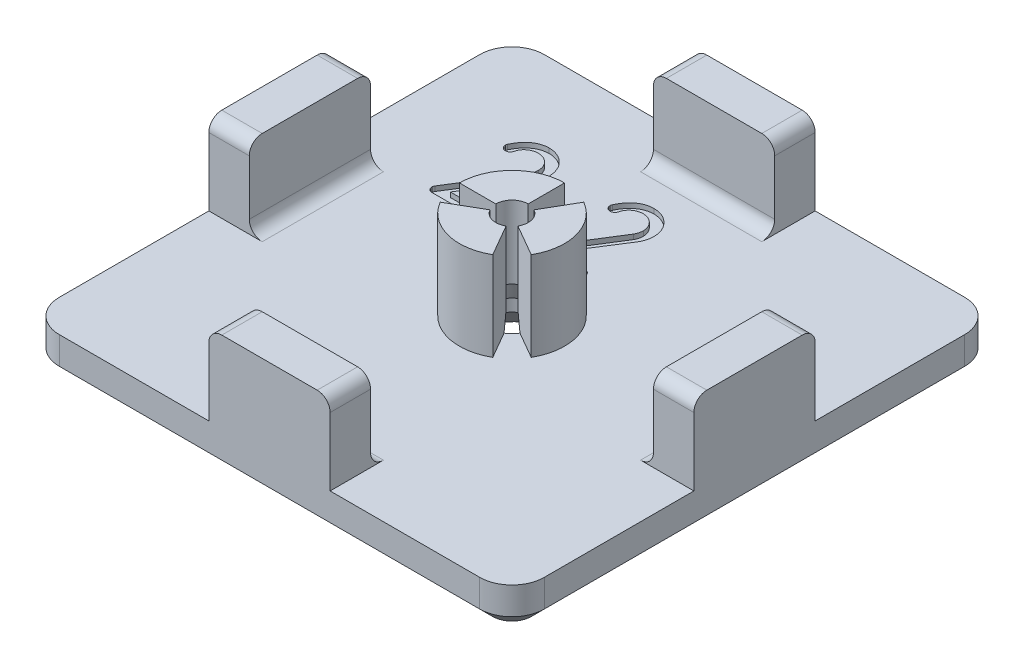
from build123d import *

# Parameters (mm, degrees)
SKETCH2_W                = 30
SKETCH2_H                = 30
EXTRUDE_MAIN_FACE_DEPTH  = 2.5
FILLET1_R                = 2
CHAMFER_BOTTOM_SIZE      = 0.8
SKETCH3_R                = 3.25
CENTER_PEG_DEPTH         = 5.5
SKETCH7_W                = 2.5
SKETCH7_H                = 7.5
BOSS_EXTRUDE1_DEPTH      = 5
FILLET7_R                = 0.8
CIRPATTERN6_COUNT        = 4
FILLET7_OF_CIRPATTERN6_R = 0.8
CUT_CYLINDER_NOTCH_REACH = 24.672
CIRPATTERN7_COUNT        = 3
CHAMF_SCREWHOLE_SIZE     = 1.75
CUT_VERSION_NUMBER_DEPTH = 0.3


with BuildPart() as part:
    # Sketch2 → extrude main face (new body)
    with BuildSketch(Plane(origin=(0, 0, 0), x_dir=(1, 0, 0), z_dir=(0, 1, 0))):
        Rectangle(SKETCH2_W, SKETCH2_H)
    extrude(amount=EXTRUDE_MAIN_FACE_DEPTH)

    # Fillet1
    fillet1_edges = [part.edges().sort_by_distance(p)[0] for p in [
        (15, 1.25, 15),
        (-15, 1.25, 15),
        (-15, 1.25, -15),
        (15, 1.25, -15),
    ]]
    fillet(fillet1_edges, radius=FILLET1_R)

    # chamfer bottom
    chamfer_bottom_edges = [part.edges().sort_by_distance(p)[0] for p in [
        (0, 0, -15),
        (15, 0, 0),
        (0, 0, 15),
        (-15, 0, 0),
        (14.414213562, 0, 14.414213562),
        (-14.414213562, 0, 14.414213562),
        (-14.414213562, 0, -14.414213562),
        (14.414213562, 0, -14.414213562),
    ]]
    chamfer(chamfer_bottom_edges, length=CHAMFER_BOTTOM_SIZE)

    # Sketch3 → center peg (add)
    with BuildSketch(Plane(origin=(0, 2.5, 0), x_dir=(1, 0, 0), z_dir=(0, 1, 0))):
        with Locations(Location((0, 0, 0), (0, 0, 270))):
            Circle(SKETCH3_R)
    extrude(amount=CENTER_PEG_DEPTH)

    # Sketch7 → Boss-Extrude1 (add)
    with BuildSketch(Plane(origin=(0, 2.5, 0), x_dir=(1, 0, 0), z_dir=(0, 1, 0))):
        with Locations((-13.75, 0)):
            Rectangle(SKETCH7_W, SKETCH7_H)
    boss_extrude1 = extrude(amount=BOSS_EXTRUDE1_DEPTH)

    # Fillet7
    fillet7_edges = [part.edges().sort_by_distance(p)[0] for p in [
        (-12.5, 2.5, 0),
        (-13.75, 7.5, 3.75),
        (-13.75, 7.5, -3.75),
    ]]
    fillet(fillet7_edges, radius=FILLET7_R)

    # CirPattern6: Boss-Extrude1 ×4 about axis
    cirpattern6_axis = Axis((0, 0, 0), (0, 1, 0))
    for i in range(1, CIRPATTERN6_COUNT):
        add(boss_extrude1.rotate(cirpattern6_axis, i * 360 / CIRPATTERN6_COUNT))

    # Fillet7 of CirPattern6
    fillet7_of_cirpattern6_edges = [part.edges().sort_by_distance(p)[0] for p in [
        (0, 2.5, 12.5),
        (3.75, 7.5, 13.75),
        (-3.75, 7.5, 13.75),
        (12.5, 2.5, 0),
        (13.75, 7.5, -3.75),
        (13.75, 7.5, 3.75),
        (0, 2.5, -12.5),
        (-3.75, 7.5, -13.75),
        (3.75, 7.5, -13.75),
    ]]
    fillet(fillet7_of_cirpattern6_edges, radius=FILLET7_OF_CIRPATTERN6_R)

    # Sketch8 → Cut-Revolve1 (revolve, cut)
    with BuildSketch(Plane.XY, mode=Mode.PRIVATE) as cut_revolve1_sk:
        Polygon((0, 0), (0, 8), (1, 8), (1, 3.5), (1.35, 2.5), (1.35, 0), align=None)
    revolve(cut_revolve1_sk.sketch.rotate(Axis((0, 0, 0), (0, 1, 0)), 90), axis=Axis((0, 0, 0), (0, 1, 0)), mode=Mode.SUBTRACT)

    # cut cylinder notch: up to this face of the body (flat: up to its plane)
    cut_cylinder_notch_end = Plane(part.part.faces().sort_by_distance((-4.174264069, 2.5, 13.35))[0])
    # Sketch9 → cut cylinder notch (cut, up to the picked face)
    with BuildSketch(Plane(origin=(0, 8, 0), x_dir=(1, 0, 0), z_dir=(0, 1, 0)), mode=Mode.PRIVATE) as cut_cylinder_notch_sk1:
        with BuildLine():
            Line((0, 0), (0, 3.25))
            ThreePointArc((0, 3.25), (0.841161897, 3.139258935), (1.625, 2.814582562))
            Line((1.625, 2.814582562), (0, 0))
        make_face()
    cut_cylinder_notch_tool1 = split(extrude(cut_cylinder_notch_sk1.sketch, amount=-CUT_CYLINDER_NOTCH_REACH, mode=Mode.PRIVATE), bisect_by=cut_cylinder_notch_end, keep=Keep.BOTH, mode=Mode.PRIVATE)
    cut_cylinder_notch = cut_cylinder_notch_tool1.solids().sort_by(Axis((0.554391, 8, -2.069014), (0, -1, 0)))[0]
    add(cut_cylinder_notch, mode=Mode.SUBTRACT)

    # CirPattern7: cut cylinder notch ×3 about axis
    cirpattern7_axis = Axis((0, 0, 0), (0, 1, 0))
    for i in range(1, CIRPATTERN7_COUNT):
        add(cut_cylinder_notch.rotate(cirpattern7_axis, i * 360 / CIRPATTERN7_COUNT), mode=Mode.SUBTRACT)

    # chamf screwHole
    chamf_screwhole_edges = [part.edges().sort_by_distance(p)[0] for p in [
        (0, 0, 1.35),
    ]]
    chamfer(chamf_screwhole_edges, length=CHAMF_SCREWHOLE_SIZE)

    # Sketch10 → cut version Number (cut)
    with BuildSketch(Plane(origin=(0, 2.5, 0), x_dir=(1, 0, 0), z_dir=(0, 1, 0))):
        with BuildLine():
            add(Edge.make_bspline(
                [(-6.564995585, 7.849162088), (-6.529853577, 7.910325815), (-6.459404249, 8.032940988), (-6.391603871, 8.233645799), (-6.346963765, 8.436853093), (-6.340784919, 8.573549532), (-6.337761401, 8.640439718)],
                knots=[0, 0, 0, 0, 1.013787966, 2.032344872, 3.037159877, 4, 4, 4, 4], degree=3))
            add(Edge.make_bspline(
                [(-6.337761401, 8.640439718), (-6.340521005, 8.69255195), (-6.345936009, 8.794808594), (-6.369313518, 8.94475644), (-6.406217036, 9.087902709), (-6.454906292, 9.225372551), (-6.517112927, 9.356361865), (-6.593675563, 9.479939943), (-6.681464601, 9.597412475), (-6.781310132, 9.706648801), (-6.89054966, 9.806480875), (-7.007996372, 9.894325933), (-7.13136068, 9.970487978), (-7.261622581, 10.033359658), (-7.398859249, 10.081689256), (-7.541974601, 10.118657688), (-7.691930868, 10.142017516), (-7.794186347, 10.147434964), (-7.846297986, 10.150195815)],
                knots=[0, 0, 0, 0, 1.058443009, 2.076917897, 3.073239101, 4.054247521, 5.031990651, 6.00955979, 6.999406302, 8.003719833, 9.008033365, 9.997879877, 10.975449016, 11.945752479, 12.926760899, 13.923082103, 14.941556991, 16, 16, 16, 16], degree=3))
            add(Edge.make_bspline(
                [(-7.846297986, 10.150195815), (-7.888216266, 10.14838627), (-7.970702041, 10.144825492), (-8.092674029, 10.128637178), (-8.210677712, 10.103402732), (-8.3243811, 10.067792617), (-8.433779889, 10.023147183), (-8.540109949, 9.971443336), (-8.641451616, 9.908332231), (-8.77148994, 9.81431157), (-8.92048571, 9.677685322), (-9.079987849, 9.493558871), (-9.220058481, 9.288578086), (-9.293245286, 9.138613981), (-9.330444328, 9.062390937)],
                knots=[0, 0, 0, 0, 0.775863489, 1.526725378, 2.27305486, 3.005618887, 3.727569145, 4.457348924, 5.189912951, 5.932977202, 7.423702791, 8.916361755, 10.432662988, 12, 12, 12, 12], degree=3))
            add(Edge.make_bspline(
                [(-9.330444328, 9.062390937), (-9.338062413, 9.043936463), (-9.353696096, 9.006064561), (-9.355254876, 8.965100879), (-9.356054084, 8.944098254)],
                knots=[0, 0, 0, 0, 0.974573408, 2, 2, 2, 2], degree=3))
            add(Edge.make_bspline(
                [(-9.356054084, 8.944098254), (-9.354414474, 8.923226517), (-9.351239612, 8.8828115), (-9.333271132, 8.825451755), (-9.30662223, 8.772951254), (-9.268012067, 8.728481735), (-9.223542548, 8.689871572), (-9.171042046, 8.663222669), (-9.113682301, 8.64525419), (-9.073267284, 8.642079328), (-9.052395547, 8.640439718)],
                knots=[0, 0, 0, 0, 1.052730986, 2.038457085, 3.010444171, 4, 4.989555829, 5.961542915, 6.947269014, 8, 8, 8, 8], degree=3))
            add(Edge.make_bspline(
                [(-9.052395547, 8.640439718), (-9.017691189, 8.644870073), (-8.951947902, 8.653262856), (-8.864045842, 8.698465552), (-8.795761969, 8.768697927), (-8.77044011, 8.828734774), (-8.757273596, 8.859951913)],
                knots=[0, 0, 0, 0, 1.065202536, 2.017899786, 2.969374635, 4, 4, 4, 4], degree=3))
            add(Edge.make_bspline(
                [(-8.757273596, 8.859951913), (-8.744010433, 8.909770858), (-8.718043062, 9.007309205), (-8.649339519, 9.140949453), (-8.559061771, 9.257475378), (-8.448131489, 9.354844956), (-8.322739534, 9.43429714), (-8.184741725, 9.492209079), (-8.036170871, 9.526853173), (-7.933877202, 9.532618762), (-7.88166384, 9.535561669)],
                knots=[0, 0, 0, 0, 1.030680226, 2.017923977, 2.987398872, 3.96827074, 4.96037523, 5.949767355, 6.953507688, 8, 8, 8, 8], degree=3))
            add(Edge.make_bspline(
                [(-7.88166384, 9.535561669), (-7.820272741, 9.52926254), (-7.700048614, 9.516926758), (-7.529374679, 9.460631454), (-7.375019137, 9.37494176), (-7.240445781, 9.261282689), (-7.127579157, 9.126543098), (-7.0441493, 8.972492337), (-6.993117668, 8.802052308), (-6.983928567, 8.68305819), (-6.979224816, 8.622147035)],
                knots=[0, 0, 0, 0, 1.043300576, 2.043128441, 3.020592189, 4.018068269, 5.011134672, 5.981974443, 6.967005516, 8, 8, 8, 8], degree=3))
            add(Edge.make_bspline(
                [(-6.979224816, 8.622147035), (-6.980382537, 8.580136756), (-6.982684581, 8.496602456), (-7.008735917, 8.374729262), (-7.046910578, 8.256241418), (-7.086171123, 8.183417796), (-7.106054084, 8.146537278)],
                knots=[0, 0, 0, 0, 1.010874498, 2.01004839, 2.992216505, 4, 4, 4, 4], degree=3))
            Line((-7.106054084, 8.146537278), (-9.3392584, 4.591906943))
            add(Edge.make_bspline(
                [(-9.3392584, 4.591906943), (-9.352590227, 4.569209283), (-9.380336525, 4.521970743), (-9.386828027, 4.467512033), (-9.390200425, 4.439220205)],
                knots=[0, 0, 0, 0, 0.960980606, 2, 2, 2, 2], degree=3))
            add(Edge.make_bspline(
                [(-9.390200425, 4.439220205), (-9.389025141, 4.418351244), (-9.386725114, 4.377510767), (-9.368831932, 4.319684204), (-9.341983034, 4.266859298), (-9.303380608, 4.222381486), (-9.258902796, 4.18377906), (-9.20607789, 4.156930162), (-9.148251327, 4.13903698), (-9.10741085, 4.136736953), (-9.086541889, 4.135561669)],
                knots=[0, 0, 0, 0, 1.045974665, 2.046968367, 3.014737927, 4, 4.985262073, 5.953031633, 6.954025335, 8, 8, 8, 8], degree=3))
            Line((-9.086541889, 4.135561669), (-6.67556747, 4.135561669))
            add(Edge.make_bspline(
                [(-6.67556747, 4.135561669), (-6.655109532, 4.136771741), (-6.614686088, 4.139162757), (-6.557250053, 4.1569288), (-6.504424812, 4.183779427), (-6.459947091, 4.222381387), (-6.42134464, 4.266859324), (-6.39449575, 4.319684197), (-6.376602565, 4.377510769), (-6.374302539, 4.418351244), (-6.373127255, 4.439220205)],
                knots=[0, 0, 0, 0, 1.028290674, 2.031829889, 3.002060474, 3.989828055, 4.977595636, 5.947826221, 6.951365436, 8, 8, 8, 8], degree=3))
            add(Edge.make_bspline(
                [(-6.373127255, 4.439220205), (-6.374213483, 4.460112437), (-6.376298672, 4.500218402), (-6.394779913, 4.556680288), (-6.421367337, 4.607996068), (-6.460013759, 4.651206838), (-6.504484121, 4.688722442), (-6.557567002, 4.71394922), (-6.615039168, 4.732166492), (-6.655904254, 4.734413484), (-6.676785791, 4.735561669)],
                knots=[0, 0, 0, 0, 1.058535215, 2.032026861, 2.993167411, 3.974516965, 4.958471876, 5.928450685, 6.941464785, 8, 8, 8, 8], degree=3))
            Line((-6.676785791, 4.735561669), (-8.546894642, 4.735561669))
            Line((-8.546894642, 4.735561669), (-6.564995585, 7.849162088))
        make_face()
        with BuildLine():
            add(Edge.make_bspline(
                [(-4.871707666, 4.442450007), (-4.870633506, 4.421317953), (-4.868543861, 4.380208146), (-4.85059255, 4.322065779), (-4.823306309, 4.269231318), (-4.785584494, 4.223539085), (-4.74021535, 4.185278213), (-4.688169899, 4.156630717), (-4.629905544, 4.139131758), (-4.58910021, 4.136769005), (-4.568249206, 4.135561669)],
                knots=[0, 0, 0, 0, 1.053795159, 2.050028647, 3.013195991, 4.009429478, 4.990006149, 5.962765968, 6.958999455, 8, 8, 8, 8], degree=3))
            add(Edge.make_bspline(
                [(-4.568249206, 4.135561669), (-4.547383916, 4.136718493), (-4.506940505, 4.138960776), (-4.449231075, 4.156912462), (-4.397495725, 4.185253193), (-4.352134394, 4.223545867), (-4.314414789, 4.269229826), (-4.287112103, 4.322065218), (-4.269303255, 4.37996527), (-4.266991473, 4.420795503), (-4.265810181, 4.44165923)],
                knots=[0, 0, 0, 0, 1.045213593, 2.025948432, 3.002645121, 3.987190297, 4.987455656, 5.954521048, 6.954786407, 8, 8, 8, 8], degree=3))
            Line((-4.265810181, 4.44165923), (-4.264790745, 4.740813669))
            add(Edge.make_bspline(
                [(-4.264790745, 4.740813669), (-4.266369663, 4.762364209), (-4.269437689, 4.804239484), (-4.287145157, 4.863578059), (-4.313731451, 4.917402869), (-4.352263244, 4.962212084), (-4.397529565, 4.999440592), (-4.449557901, 5.026180985), (-4.506902125, 5.044434217), (-4.547370853, 5.046626014), (-4.568249206, 5.047756791)],
                knots=[0, 0, 0, 0, 1.076562654, 2.091889952, 3.072719245, 4.052917712, 5.020200157, 5.982996012, 6.959400964, 8, 8, 8, 8], degree=3))
            add(Edge.make_bspline(
                [(-4.568249206, 5.047756791), (-4.589113293, 5.046575481), (-4.629944232, 5.044263663), (-4.687839221, 5.02645507), (-4.740182228, 4.999415443), (-4.785452173, 4.962218513), (-4.824002991, 4.917402745), (-4.850508301, 4.863572023), (-4.868563383, 4.804179253), (-4.870769906, 4.762125541), (-4.871907742, 4.740439718)],
                knots=[0, 0, 0, 0, 1.037498569, 2.03038068, 2.990307883, 3.954708309, 4.931986273, 5.909893183, 6.922195311, 8, 8, 8, 8], degree=3))
            Line((-4.871907742, 4.740439718), (-4.871707666, 4.442450007))
        make_face()
        with BuildLine():
            add(Edge.make_bspline(
                [(-0.086946805, 7.849162088), (-0.051804796, 7.910325815), (0.018644532, 8.032940988), (0.086444909, 8.233645799), (0.131085016, 8.436853093), (0.137263862, 8.573549532), (0.14028738, 8.640439718)],
                knots=[0, 0, 0, 0, 1.013787966, 2.032344872, 3.037159877, 4, 4, 4, 4], degree=3))
            add(Edge.make_bspline(
                [(0.14028738, 8.640439718), (0.137527775, 8.69255195), (0.132112772, 8.794808594), (0.108735263, 8.94475644), (0.071831744, 9.087902709), (0.023142488, 9.225372551), (-0.039064146, 9.356361865), (-0.115626783, 9.479939943), (-0.20341582, 9.597412475), (-0.303261352, 9.706648801), (-0.412500879, 9.806480875), (-0.529947591, 9.894325933), (-0.6533119, 9.970487978), (-0.783573801, 10.033359658), (-0.920810469, 10.081689256), (-1.06392582, 10.118657688), (-1.213882088, 10.142017516), (-1.316137566, 10.147434964), (-1.368249206, 10.150195815)],
                knots=[0, 0, 0, 0, 1.058443009, 2.076917897, 3.073239101, 4.054247521, 5.031990651, 6.00955979, 6.999406302, 8.003719833, 9.008033365, 9.997879877, 10.975449016, 11.945752479, 12.926760899, 13.923082103, 14.941556991, 16, 16, 16, 16], degree=3))
            add(Edge.make_bspline(
                [(-1.368249206, 10.150195815), (-1.410167486, 10.14838627), (-1.492653261, 10.144825492), (-1.614625249, 10.128637178), (-1.732628932, 10.103402732), (-1.846332319, 10.067792617), (-1.955731109, 10.023147183), (-2.062061168, 9.971443336), (-2.163402836, 9.908332231), (-2.293441159, 9.81431157), (-2.44243693, 9.677685322), (-2.601939068, 9.493558871), (-2.742009701, 9.288578086), (-2.815196505, 9.138613981), (-2.852395547, 9.062390937)],
                knots=[0, 0, 0, 0, 0.775863489, 1.526725378, 2.27305486, 3.005618887, 3.727569145, 4.457348924, 5.189912951, 5.932977202, 7.423702791, 8.916361755, 10.432662988, 12, 12, 12, 12], degree=3))
            add(Edge.make_bspline(
                [(-2.852395547, 9.062390937), (-2.860013633, 9.043936463), (-2.875647316, 9.006064561), (-2.877206096, 8.965100879), (-2.878005303, 8.944098254)],
                knots=[0, 0, 0, 0, 0.974573408, 2, 2, 2, 2], degree=3))
            add(Edge.make_bspline(
                [(-2.878005303, 8.944098254), (-2.876365693, 8.923226517), (-2.873190831, 8.8828115), (-2.855222352, 8.825451755), (-2.828573449, 8.772951254), (-2.789963286, 8.728481735), (-2.745493767, 8.689871572), (-2.692993266, 8.663222669), (-2.635633521, 8.64525419), (-2.595218504, 8.642079328), (-2.574346767, 8.640439718)],
                knots=[0, 0, 0, 0, 1.052730986, 2.038457085, 3.010444171, 4, 4.989555829, 5.961542915, 6.947269014, 8, 8, 8, 8], degree=3))
            add(Edge.make_bspline(
                [(-2.574346767, 8.640439718), (-2.539642409, 8.644870073), (-2.473899121, 8.653262856), (-2.385997062, 8.698465552), (-2.317713189, 8.768697927), (-2.29239133, 8.828734774), (-2.279224816, 8.859951913)],
                knots=[0, 0, 0, 0, 1.065202536, 2.017899786, 2.969374635, 4, 4, 4, 4], degree=3))
            add(Edge.make_bspline(
                [(-2.279224816, 8.859951913), (-2.265961652, 8.909770858), (-2.239994282, 9.007309205), (-2.171290739, 9.140949453), (-2.081012991, 9.257475378), (-1.970082709, 9.354844956), (-1.844690754, 9.43429714), (-1.706692945, 9.492209079), (-1.558122091, 9.526853173), (-1.455828421, 9.532618762), (-1.403615059, 9.535561669)],
                knots=[0, 0, 0, 0, 1.030680226, 2.017923977, 2.987398872, 3.96827074, 4.96037523, 5.949767355, 6.953507688, 8, 8, 8, 8], degree=3))
            add(Edge.make_bspline(
                [(-1.403615059, 9.535561669), (-1.34222396, 9.52926254), (-1.221999833, 9.516926758), (-1.051325899, 9.460631454), (-0.896970357, 9.37494176), (-0.762397001, 9.261282689), (-0.649530377, 9.126543098), (-0.56610052, 8.972492337), (-0.515068888, 8.802052308), (-0.505879787, 8.68305819), (-0.501176035, 8.622147035)],
                knots=[0, 0, 0, 0, 1.043300576, 2.043128441, 3.020592189, 4.018068269, 5.011134672, 5.981974443, 6.967005516, 8, 8, 8, 8], degree=3))
            add(Edge.make_bspline(
                [(-0.501176035, 8.622147035), (-0.502333757, 8.580136756), (-0.5046358, 8.496602456), (-0.530687136, 8.374729262), (-0.568861798, 8.256241418), (-0.608122343, 8.183417796), (-0.628005303, 8.146537278)],
                knots=[0, 0, 0, 0, 1.010874498, 2.01004839, 2.992216505, 4, 4, 4, 4], degree=3))
            Line((-0.628005303, 8.146537278), (-2.861209619, 4.591906943))
            add(Edge.make_bspline(
                [(-2.861209619, 4.591906943), (-2.874541446, 4.569209283), (-2.902287745, 4.521970743), (-2.908779247, 4.467512033), (-2.912151645, 4.439220205)],
                knots=[0, 0, 0, 0, 0.960980606, 2, 2, 2, 2], degree=3))
            add(Edge.make_bspline(
                [(-2.912151645, 4.439220205), (-2.91097636, 4.418351244), (-2.908676334, 4.377510767), (-2.890783151, 4.319684204), (-2.863934254, 4.266859298), (-2.825331827, 4.222381486), (-2.780854016, 4.18377906), (-2.728029109, 4.156930162), (-2.670202547, 4.13903698), (-2.62936207, 4.136736953), (-2.608493108, 4.135561669)],
                knots=[0, 0, 0, 0, 1.045974665, 2.046968367, 3.014737927, 4, 4.985262073, 5.953031633, 6.954025335, 8, 8, 8, 8], degree=3))
            Line((-2.608493108, 4.135561669), (-0.197518689, 4.135561669))
            add(Edge.make_bspline(
                [(-0.197518689, 4.135561669), (-0.177060751, 4.136771741), (-0.136637308, 4.139162757), (-0.079201273, 4.1569288), (-0.026376032, 4.183779427), (0.018101689, 4.222381387), (0.05670414, 4.266859324), (0.083553031, 4.319684197), (0.101446215, 4.377510769), (0.103746242, 4.418351244), (0.104921526, 4.439220205)],
                knots=[0, 0, 0, 0, 1.028290674, 2.031829889, 3.002060474, 3.989828055, 4.977595636, 5.947826221, 6.951365436, 8, 8, 8, 8], degree=3))
            add(Edge.make_bspline(
                [(0.104921526, 4.439220205), (0.103835297, 4.460112437), (0.101750108, 4.500218402), (0.083268867, 4.556680288), (0.056681443, 4.607996068), (0.018035021, 4.651206838), (-0.026435341, 4.688722442), (-0.079518221, 4.71394922), (-0.136990388, 4.732166492), (-0.177855474, 4.734413484), (-0.198737011, 4.735561669)],
                knots=[0, 0, 0, 0, 1.058535215, 2.032026861, 2.993167411, 3.974516965, 4.958471876, 5.928450685, 6.941464785, 8, 8, 8, 8], degree=3))
            Line((-0.198737011, 4.735561669), (-2.068845862, 4.735561669))
            Line((-2.068845862, 4.735561669), (-0.086946805, 7.849162088))
        make_face()
    extrude(amount=-CUT_VERSION_NUMBER_DEPTH, mode=Mode.SUBTRACT)


solid = part.part
